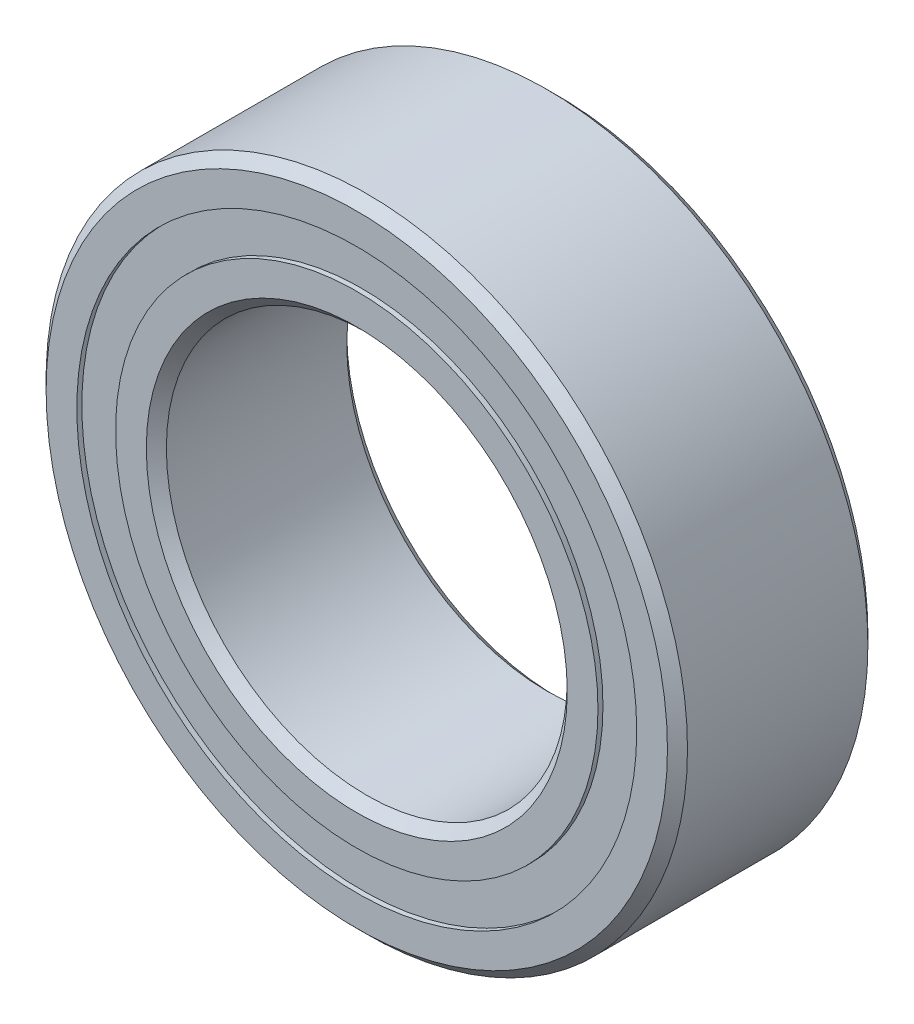
from build123d import *

# Parameters (mm, degrees)
CIRPATTERN1_COUNT = 12
SKETCH5_W         = 0.58162128
SKETCH5_H         = 0.483516484


with BuildPart() as part:
    # Sketch1 → Revolve1 (revolve)
    with BuildSketch(Plane(origin=(0, 0, 0), x_dir=(0, 0, -1), z_dir=(1, 0, 0)), mode=Mode.PRIVATE) as revolve1_sk:
        with BuildLine():
            Line((1.125, 4), (-1.125, 4))
            Line((-1.125, 4), (-1.25, 3.875))
            Line((-1.25, 3.875), (-1.25, 3.491758242))
            Line((-1.25, 3.491758242), (-0.555555556, 3.491758242))
            ThreePointArc((-0.555555556, 3.491758242), (0, 3.85587872), (0.555555556, 3.491758242))
            Line((0.555555556, 3.491758242), (1.25, 3.491758242))
            Line((1.25, 3.491758242), (1.25, 3.875))
            Line((1.25, 3.875), (1.125, 4))
        make_face()
    revolve(revolve1_sk.sketch.rotate(Axis((0, 0, 1.25), (0, 0, -1)), 90), axis=Axis((0, 0, 1.25), (0, 0, -1)))


with BuildPart() as body_2:
    # Sketch3 → Revolve3 (revolve)
    with BuildSketch(Plane(origin=(0, 0, 0), x_dir=(0, 0, -1), z_dir=(1, 0, 0)), mode=Mode.PRIVATE) as revolve3_sk:
        with BuildLine():
            Line((-1.25, 3.008241758), (-0.555555556, 3.008241758))
            ThreePointArc((-0.555555556, 3.008241758), (0, 2.64412128), (0.555555556, 3.008241758))
            Line((0.555555556, 3.008241758), (1.25, 3.008241758))
            Line((1.25, 3.008241758), (1.25, 2.625))
            Line((1.25, 2.625), (1.125, 2.5))
            Line((1.125, 2.5), (-1.125, 2.5))
            Line((-1.125, 2.5), (-1.25, 2.625))
            Line((-1.25, 2.625), (-1.25, 3.008241758))
        make_face()
    revolve(revolve3_sk.sketch.rotate(Axis((0, 0, 1.25), (0, 0, -1)), 90), axis=Axis((0, 0, 1.25), (0, 0, -1)))


with BuildPart() as body_3:
    # Sketch4 → Revolve4 (revolve)
    with BuildSketch(Plane(origin=(0, 0, 0), x_dir=(0, 0, -1), z_dir=(1, 0, 0))):
        with BuildLine():
            Line((-0.60587872, 3.25), (0.60587872, 3.25))
            ThreePointArc((0.60587872, 3.25), (0, 3.85587872), (-0.60587872, 3.25))
        make_face()
    revolve(axis=Axis((0, 3.25, 0.60587872), (0, 0, -1)))


with BuildPart() as cirpattern1_1:
    # CirPattern1: pattern copy
    add(body_3.part.rotate(Axis((0, 0, 0), (0, 0, 1)), 1 * 360 / CIRPATTERN1_COUNT))


with BuildPart() as cirpattern1_2:
    # CirPattern1: pattern copy
    add(body_3.part.rotate(Axis((0, 0, 0), (0, 0, 1)), 2 * 360 / CIRPATTERN1_COUNT))


with BuildPart() as cirpattern1_3:
    # CirPattern1: pattern copy
    add(body_3.part.rotate(Axis((0, 0, 0), (0, 0, 1)), 3 * 360 / CIRPATTERN1_COUNT))


with BuildPart() as cirpattern1_4:
    # CirPattern1: pattern copy
    add(body_3.part.rotate(Axis((0, 0, 0), (0, 0, 1)), 4 * 360 / CIRPATTERN1_COUNT))


with BuildPart() as cirpattern1_5:
    # CirPattern1: pattern copy
    add(body_3.part.rotate(Axis((0, 0, 0), (0, 0, 1)), 5 * 360 / CIRPATTERN1_COUNT))


with BuildPart() as cirpattern1_6:
    # CirPattern1: pattern copy
    add(body_3.part.rotate(Axis((0, 0, 0), (0, 0, 1)), 6 * 360 / CIRPATTERN1_COUNT))


with BuildPart() as cirpattern1_7:
    # CirPattern1: pattern copy
    add(body_3.part.rotate(Axis((0, 0, 0), (0, 0, 1)), 7 * 360 / CIRPATTERN1_COUNT))


with BuildPart() as cirpattern1_8:
    # CirPattern1: pattern copy
    add(body_3.part.rotate(Axis((0, 0, 0), (0, 0, 1)), 8 * 360 / CIRPATTERN1_COUNT))


with BuildPart() as cirpattern1_9:
    # CirPattern1: pattern copy
    add(body_3.part.rotate(Axis((0, 0, 0), (0, 0, 1)), 9 * 360 / CIRPATTERN1_COUNT))


with BuildPart() as cirpattern1_10:
    # CirPattern1: pattern copy
    add(body_3.part.rotate(Axis((0, 0, 0), (0, 0, 1)), 10 * 360 / CIRPATTERN1_COUNT))


with BuildPart() as cirpattern1_11:
    # CirPattern1: pattern copy
    add(body_3.part.rotate(Axis((0, 0, 0), (0, 0, 1)), 11 * 360 / CIRPATTERN1_COUNT))


with BuildPart() as body_15:
    # Sketch5 → Revolve5 (revolve)
    with BuildSketch(Plane(origin=(0, 0, 0), x_dir=(0, 0, -1), z_dir=(1, 0, 0)), mode=Mode.PRIVATE) as revolve5_sk:
        with Locations((-0.89668936, 3.25)):
            Rectangle(SKETCH5_W, SKETCH5_H)
        with Locations((0.89668936, 3.25)):
            Rectangle(SKETCH5_W, SKETCH5_H)
    revolve(revolve5_sk.sketch.rotate(Axis((0, 0, 1.25), (0, 0, -1)), 90), axis=Axis((0, 0, 1.25), (0, 0, -1)))


solid = Compound([part.part, body_2.part, body_3.part, cirpattern1_1.part, cirpattern1_2.part, cirpattern1_3.part, cirpattern1_4.part, cirpattern1_5.part, cirpattern1_6.part, cirpattern1_7.part, cirpattern1_8.part, cirpattern1_9.part, cirpattern1_10.part, cirpattern1_11.part, body_15.part])
